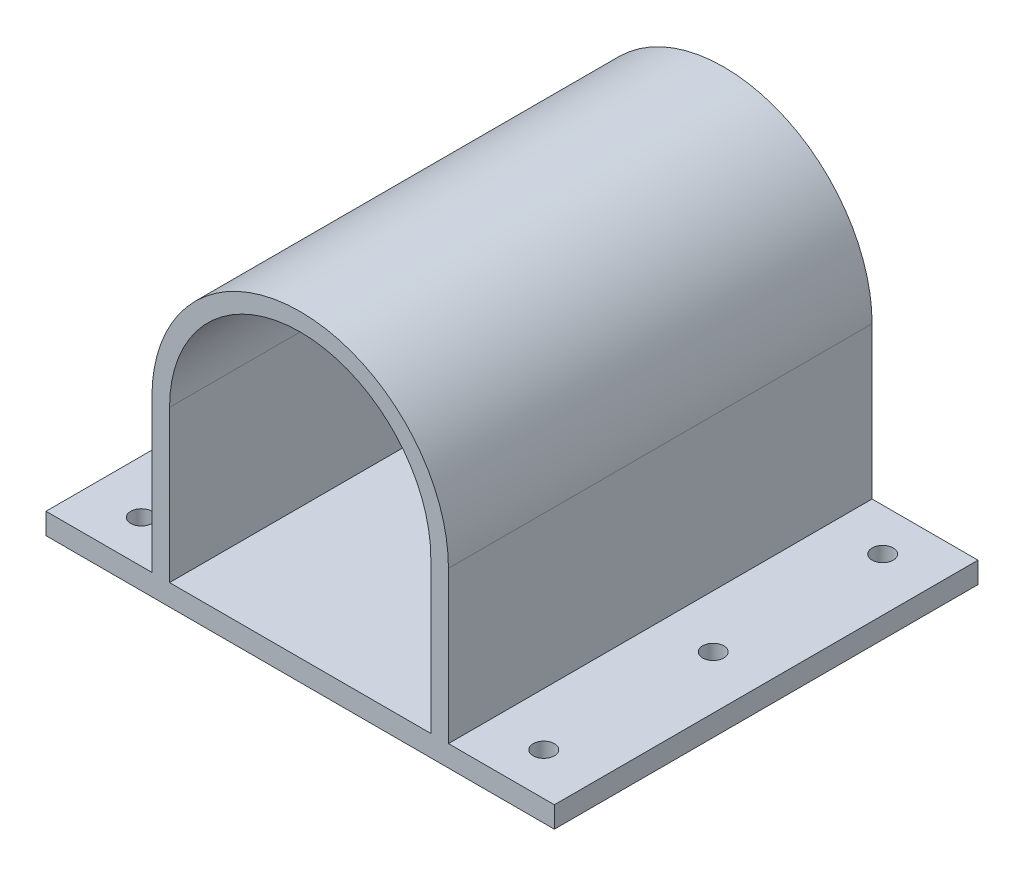
from build123d import *

# Parameters (mm, degrees)
SKETCH1_R           = 1.65
SKETCH1_R_2         = 6.15
BOSS_EXTRUDE1_DEPTH = 60
CUT_EXTRUDE1_DEPTH  = 57
SKETCH3_R           = 1.5
CUT_EXTRUDE2_DEPTH  = 82.867270628
FILLET1_R           = 6


with BuildPart() as part:
    # Sketch1 → Boss-Extrude1 (new body)
    with BuildSketch(Plane.XY):
        with BuildLine():
            Line((-21, 0), (-21, -21.5))
            Line((-21, -21.5), (-36, -21.5))
            Line((-36, -21.5), (-36, -24.5))
            Line((-36, -24.5), (36, -24.5))
            Line((36, -24.5), (36, -21.5))
            Line((36, -21.5), (21, -21.5))
            Line((21, -21.5), (21, 0))
            ThreePointArc((21, 0), (0, 21), (-21, 0))
        make_face()
        with Locations((0, -15.5)):
            Circle(SKETCH1_R, mode=Mode.SUBTRACT)
        with Locations((-13.423393759, -7.75)):
            Circle(SKETCH1_R, mode=Mode.SUBTRACT)
        with Locations((-13.423393759, 7.75)):
            Circle(SKETCH1_R, mode=Mode.SUBTRACT)
        with Locations((0, 15.5)):
            Circle(SKETCH1_R, mode=Mode.SUBTRACT)
        with Locations((13.423393759, 7.75)):
            Circle(SKETCH1_R, mode=Mode.SUBTRACT)
        with Locations((13.423393759, -7.75)):
            Circle(SKETCH1_R, mode=Mode.SUBTRACT)
        with Locations((-7, 0)):
            Circle(SKETCH1_R_2, mode=Mode.SUBTRACT)
    extrude(amount=BOSS_EXTRUDE1_DEPTH)

    # Sketch2 → Cut-Extrude1 (cut)
    with BuildSketch(Plane.XY.offset(60)):
        with BuildLine():
            Line((-18.5, 0), (-18.5, -21.5))
            Line((-18.5, -21.5), (18.5, -21.5))
            Line((18.5, -21.5), (18.5, 0))
            ThreePointArc((18.5, 0), (0, 18.5), (-18.5, 0))
        make_face()
    extrude(amount=-CUT_EXTRUDE1_DEPTH, mode=Mode.SUBTRACT)

    # Sketch3 → Cut-Extrude2 (cut, through all)
    with BuildSketch(Plane(origin=(0, -21.5, 0), x_dir=(1, 0, 0), z_dir=(0, 1, 0))):
        with Locations(Location((-28.5, -30, 0), (0, 0, 270))):
            Circle(SKETCH3_R)
        with Locations(Location((-28.5, -6, 0), (0, 0, 270))):
            Circle(SKETCH3_R)
        with Locations(Location((-28.5, -54, 0), (0, 0, 270))):
            Circle(SKETCH3_R)
        with Locations(Location((28.5, -54, 0), (0, 0, 90))):
            Circle(SKETCH3_R)
        with Locations(Location((28.5, -6, 0), (0, 0, 90))):
            Circle(SKETCH3_R)
        with Locations(Location((28.5, -30, 0), (0, 0, 90))):
            Circle(SKETCH3_R)
    extrude(amount=-CUT_EXTRUDE2_DEPTH, mode=Mode.SUBTRACT)

    # Fillet1
    fillet1_edges = [part.edges().sort_by_distance(p)[0] for p in [
        (-36, -23, 0),
    ]]
    fillet(fillet1_edges, radius=FILLET1_R)


solid = part.part
